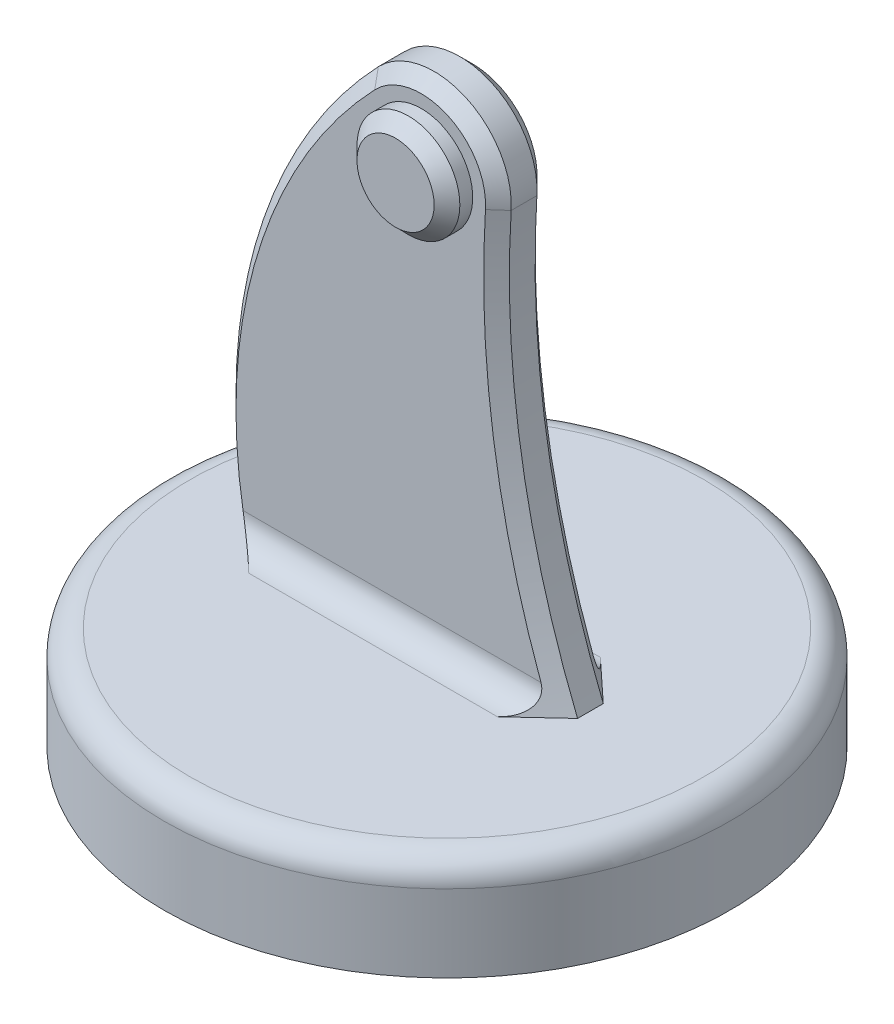
from build123d import *

# Parameters (mm, degrees)
SKETCH2_R           = 55
BOSS_EXTRUDE1_DEPTH = 20
FILLET1_R           = 5
BOSS_EXTRUDE2_DEPTH = 5
CHAMFER1_SIZE       = 2.5
CHAMFER2_SIZE       = 2.5
FILLET2_R           = 5
SKETCH4_R           = 10
BOSS_EXTRUDE3_DEPTH = 5
CHAMFER3_SIZE       = 2.5
SKETCH5_R           = 5
CUT_EXTRUDE1_DEPTH  = 10
SKETCH8_R           = 50
CUT_EXTRUDE2_DEPTH  = 15


with BuildPart() as part:
    # Sketch2 → Boss-Extrude1 (new body)
    with BuildSketch(Plane(origin=(0, 0, 0), x_dir=(1, 0, 0), z_dir=(0, 1, 0))):
        with Locations(Location((0, 0, 0), (0, 0, 270))):
            Circle(SKETCH2_R)
    extrude(amount=BOSS_EXTRUDE1_DEPTH)

    # Fillet1
    fillet1_edges = [part.edges().sort_by_distance(p)[0] for p in [
        (0, 20, -55),
    ]]
    fillet(fillet1_edges, radius=FILLET1_R)

    # Sketch3 → Boss-Extrude2 (add, symmetric)
    with BuildSketch(Plane.XY):
        with BuildLine():
            Line((-35, 15), (30, 15))
            ThreePointArc((30, 15), (17.428098582, 56.126843631), (14.970645506, 99.06203778))
            ThreePointArc((14.970645506, 99.06203778), (6.012327577, 113.742340307), (-10.849201429, 110.358321696))
            ThreePointArc((-10.849201429, 110.358321696), (-35.460543036, 65.854059614), (-35, 15))
        make_face()
    extrude(amount=BOSS_EXTRUDE2_DEPTH, both=True)

    # Chamfer1
    chamfer1_edges = [part.edges().sort_by_distance(p)[0] for p in [
        (16.970295051, 58.803839559, 5),
        (6.012327577, 113.742340307, 5),
        (-34.796467261, 68.341174934, 5),
    ]]
    chamfer(chamfer1_edges, length=CHAMFER1_SIZE)

    # Chamfer2
    chamfer2_edges = [part.edges().sort_by_distance(p)[0] for p in [
        (-34.796467261, 68.341174934, -5),
        (16.970295051, 58.803839559, -5),
        (6.012327577, 113.742340307, -5),
    ]]
    chamfer(chamfer2_edges, length=CHAMFER2_SIZE)

    # Fillet2
    fillet2_edges = [part.edges().sort_by_distance(p)[0] for p in [
        (-4.241511046, 20, 5),
        (-4.241511046, 20, -5),
    ]]
    fillet(fillet2_edges, radius=FILLET2_R)

    # Sketch4 → Boss-Extrude3 (add)
    with BuildSketch(Plane.XY.offset(5)):
        with Locations(Location((0, 100, 0), (0, 0, 180))):
            Circle(SKETCH4_R)
    extrude(amount=BOSS_EXTRUDE3_DEPTH)

    # Chamfer3
    chamfer3_edges = [part.edges().sort_by_distance(p)[0] for p in [
        (10, 100, 10),
    ]]
    chamfer(chamfer3_edges, length=CHAMFER3_SIZE)

    # Sketch5 → Cut-Extrude1 (cut)
    with BuildSketch(Plane(origin=(0, 0, -5), x_dir=(-1, 0, 0), z_dir=(0, 0, -1))):
        with Locations((0, 100)):
            Circle(SKETCH5_R)
    extrude(amount=-CUT_EXTRUDE1_DEPTH, mode=Mode.SUBTRACT)

    # Sketch8 → Cut-Extrude2 (cut)
    with BuildSketch(Plane.XZ):
        with Locations(Location((0, 0, 0), (0, 0, 270))):
            Circle(SKETCH8_R)
    extrude(amount=-CUT_EXTRUDE2_DEPTH, mode=Mode.SUBTRACT)


solid = part.part
